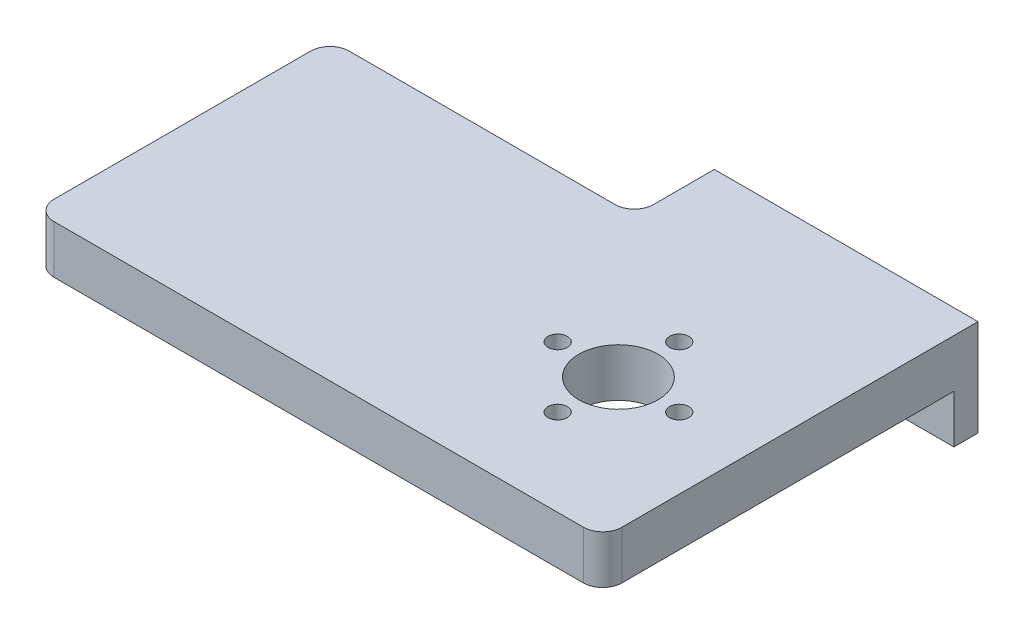
from build123d import *

# Parameters (mm, degrees)
SKETCH1_W           = 74.754
SKETCH1_H           = 38.862
SKETCH1_R           = 5.207
SKETCH1_R_2         = 16.256
SKETCH1_W_2         = 34.7
SKETCH1_H_2         = 10.541
BOSS_EXTRUDE1_DEPTH = 6.35
BOSS_EXTRUDE2_START = -3.175
SKETCH2_R           = 16.256
BOSS_EXTRUDE2_DEPTH = 3.175
SKETCH3_W           = 34.7
SKETCH3_H           = 3.175
BOSS_EXTRUDE3_DEPTH = 12.7
FILLET1_R           = 2.54
SKETCH4_R           = 1.27
CUT_EXTRUDE1_DEPTH  = 65.944794531


with BuildPart() as part:
    # Sketch1 → Boss-Extrude1 (new body)
    # profile 1 of 2: a face of its own
    with BuildSketch(Plane(origin=(0, 0, 0), x_dir=(1, 0, 0), z_dir=(0, 1, 0))):
        with Locations((-4.886569512, -28.216948841)):
            Rectangle(SKETCH1_W, SKETCH1_H)
        with Locations(Location((15.140430488, -28.216948841, 0), (0, 0, 270))):
            Circle(SKETCH1_R, mode=Mode.SUBTRACT)
        with Locations(Location((-19.657569512, -28.216948841, 0), (0, 0, 270))):
            Circle(SKETCH1_R_2, mode=Mode.SUBTRACT)
    # profile 2 of 2: a face of its own
    with BuildSketch(Plane(origin=(0, 0, 0), x_dir=(1, 0, 0), z_dir=(0, 1, 0))):
        with Locations((15.140430488, -3.515448841)):
            Rectangle(SKETCH1_W_2, SKETCH1_H_2)
    extrude(amount=BOSS_EXTRUDE1_DEPTH)

    # Sketch2 → Boss-Extrude2 (add)
    with BuildSketch(Plane(origin=(0, 6.35, 0), x_dir=(1, 0, 0), z_dir=(0, 1, 0)).offset(BOSS_EXTRUDE2_START)):
        with Locations(Location((-19.657569512, -28.216948841, 0), (0, 0, 270))):
            Circle(SKETCH2_R)
    extrude(amount=BOSS_EXTRUDE2_DEPTH)

    # Sketch3 → Boss-Extrude3 (add)
    with BuildSketch(Plane(origin=(0, 6.35, 0), x_dir=(1, 0, 0), z_dir=(0, 1, 0))):
        with Locations((15.140430488, 0.167551159)):
            Rectangle(SKETCH3_W, SKETCH3_H)
    extrude(amount=-BOSS_EXTRUDE3_DEPTH)

    # Fillet1
    fillet1_edges = [part.edges().sort_by_distance(p)[0] for p in [
        (32.490430488, 3.175, 47.647948841),
        (-42.263569512, 3.175, 47.647948841),
        (-42.263569512, 3.175, 8.785948841),
        (-2.209569512, 3.175, 8.785948841),
    ]]
    fillet(fillet1_edges, radius=FILLET1_R)

    # Sketch4 → Cut-Extrude1 (cut, through all)
    with BuildSketch(Plane(origin=(0, 6.35, 0), x_dir=(1, 0, 0), z_dir=(0, 1, 0))):
        with Locations(Location((15.140430488, -20.215948841, 0), (0, 0, 270))):
            Circle(SKETCH4_R)
        with Locations(Location((23.141430488, -28.216948841, 0), (0, 0, 270))):
            Circle(SKETCH4_R)
        with Locations(Location((15.140430488, -36.217948841, 0), (0, 0, 270))):
            Circle(SKETCH4_R)
        with Locations(Location((7.139430488, -28.216948841, 0), (0, 0, 270))):
            Circle(SKETCH4_R)
    extrude(amount=-CUT_EXTRUDE1_DEPTH, mode=Mode.SUBTRACT)


solid = part.part
